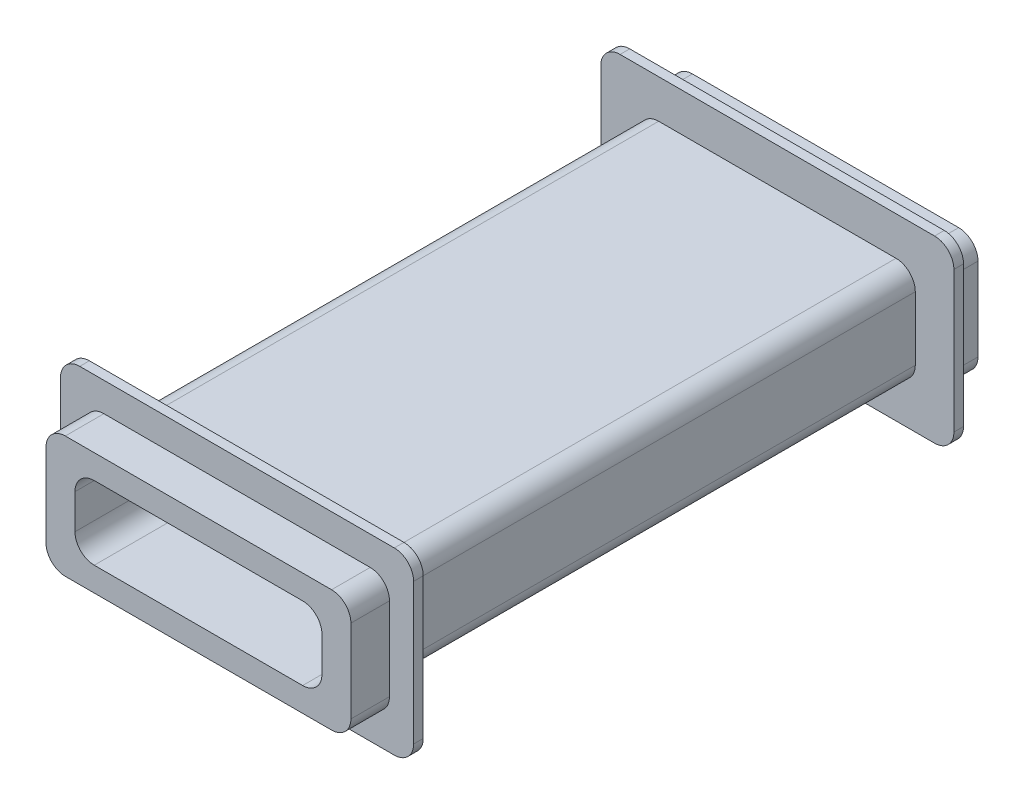
from build123d import *

# Parameters (mm, degrees)
SKETCH1_W           = 28.6
SKETCH1_H           = 10.6
SKETCH1_W_2         = 25.6
SKETCH1_H_2         = 7.6
BOSS_EXTRUDE1_DEPTH = 55
SKETCH2_W           = 36.6
SKETCH2_H           = 18.6
SKETCH2_W_2         = 25.6
SKETCH2_H_2         = 7.6
BOSS_EXTRUDE3_DEPTH = 1
SKETCH3_W           = 31.6
SKETCH3_H           = 12.6
SKETCH3_W_2         = 25.6
SKETCH3_H_2         = 7.6
BOSS_EXTRUDE4_DEPTH = 4
FILLET1_R           = 2
FILLET2_R           = 2


with BuildPart() as part:
    # Sketch1 → Boss-Extrude1 (new body)
    with BuildSketch(Plane.XY):
        Rectangle(SKETCH1_W, SKETCH1_H)
        Rectangle(SKETCH1_W_2, SKETCH1_H_2, mode=Mode.SUBTRACT)
    extrude(amount=BOSS_EXTRUDE1_DEPTH)

    # Sketch2 → Boss-Extrude3 (add)
    with BuildSketch(Plane.XY.offset(55)):
        Rectangle(SKETCH2_W, SKETCH2_H)
        Rectangle(SKETCH2_W_2, SKETCH2_H_2, mode=Mode.SUBTRACT)
    boss_extrude3 = extrude(amount=BOSS_EXTRUDE3_DEPTH)

    # Sketch3 → Boss-Extrude4 (add)
    with BuildSketch(Plane.XY.offset(56)):
        Rectangle(SKETCH3_W, SKETCH3_H)
        Rectangle(SKETCH3_W_2, SKETCH3_H_2, mode=Mode.SUBTRACT)
    boss_extrude4 = extrude(amount=BOSS_EXTRUDE4_DEPTH)

    # Mirror1: Boss-Extrude3, Boss-Extrude4 across plane
    add(boss_extrude3.mirror(Plane(origin=(0, 0, 27.5), x_dir=(1, 0, 0), z_dir=(0, 0, -1))))
    add(boss_extrude4.mirror(Plane(origin=(0, 0, 27.5), x_dir=(1, 0, 0), z_dir=(0, 0, -1))))

    # Fillet1
    fillet1_edges = [part.edges().sort_by_distance(p)[0] for p in [
        (12.8, -3.8, 27.5),
        (12.8, 3.8, 27.5),
        (-12.8, 3.8, 27.5),
        (-12.8, -3.8, 27.5),
        (15.8, -6.3, 58),
        (15.8, 6.3, 58),
        (-15.8, 6.3, 58),
        (-15.8, -6.3, 58),
        (14.3, -5.3, 27.5),
        (-14.3, -5.3, 27.5),
        (-14.3, 5.3, 27.5),
        (14.3, 5.3, 27.5),
        (15.8, 6.3, -3),
        (15.8, -6.3, -3),
        (-15.8, -6.3, -3),
        (-15.8, 6.3, -3),
    ]]
    fillet(fillet1_edges, radius=FILLET1_R)

    # Fillet2
    fillet2_edges = [part.edges().sort_by_distance(p)[0] for p in [
        (18.3, -9.3, 55.5),
        (18.3, 9.3, 55.5),
        (-18.3, 9.3, 55.5),
        (-18.3, -9.3, 55.5),
        (18.3, 9.3, -0.5),
        (18.3, -9.3, -0.5),
        (-18.3, -9.3, -0.5),
        (-18.3, 9.3, -0.5),
    ]]
    fillet(fillet2_edges, radius=FILLET2_R)


solid = part.part
